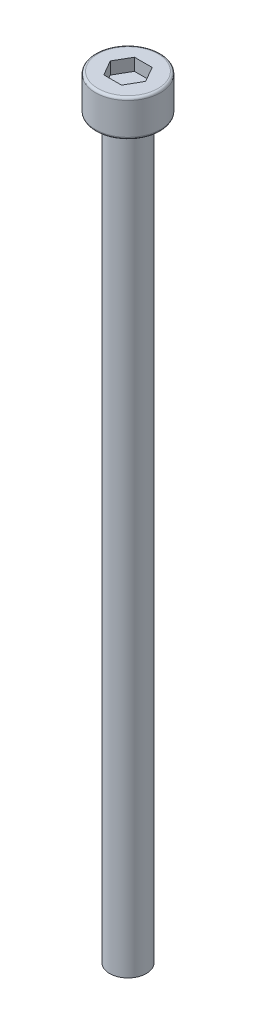
from build123d import *

# Parameters (mm, degrees)
SKETCH1_R           = 2.65
BOSS_EXTRUDE1_DEPTH = 3
CUT_EXTRUDE1_DEPTH  = 1
SKETCH3_R           = 1.5
BOSS_EXTRUDE2_DEPTH = 60
FILLET1_R           = 0.2


with BuildPart() as part:
    # Sketch1 → Boss-Extrude1 (new body)
    with BuildSketch(Plane(origin=(0, 0, 0), x_dir=(1, 0, 0), z_dir=(0, 1, 0))):
        with Locations(Location((0, 0, 0), (0, 0, 270))):
            Circle(SKETCH1_R)
    extrude(amount=BOSS_EXTRUDE1_DEPTH)

    # Sketch2 → Cut-Extrude1 (cut)
    with BuildSketch(Plane(origin=(0, 3, 0), x_dir=(1, 0, 0), z_dir=(0, 1, 0))):
        Polygon((1.443375673, 0), (0.721687836, 1.25), (-0.721687836, 1.25), (-1.443375673, 0), (-0.721687836, -1.25), (0.721687836, -1.25), align=None)
    extrude(amount=-CUT_EXTRUDE1_DEPTH, mode=Mode.SUBTRACT)

    # Sketch3 → Boss-Extrude2 (add)
    with BuildSketch(Plane.XZ):
        with Locations(Location((0, 0, 0), (0, 0, 270))):
            Circle(SKETCH3_R)
    extrude(amount=BOSS_EXTRUDE2_DEPTH)

    # Fillet1
    fillet1_edges = [part.edges().sort_by_distance(p)[0] for p in [
        (0, 0, -2.65),
        (0, 3, -2.65),
    ]]
    fillet(fillet1_edges, radius=FILLET1_R)


solid = part.part
